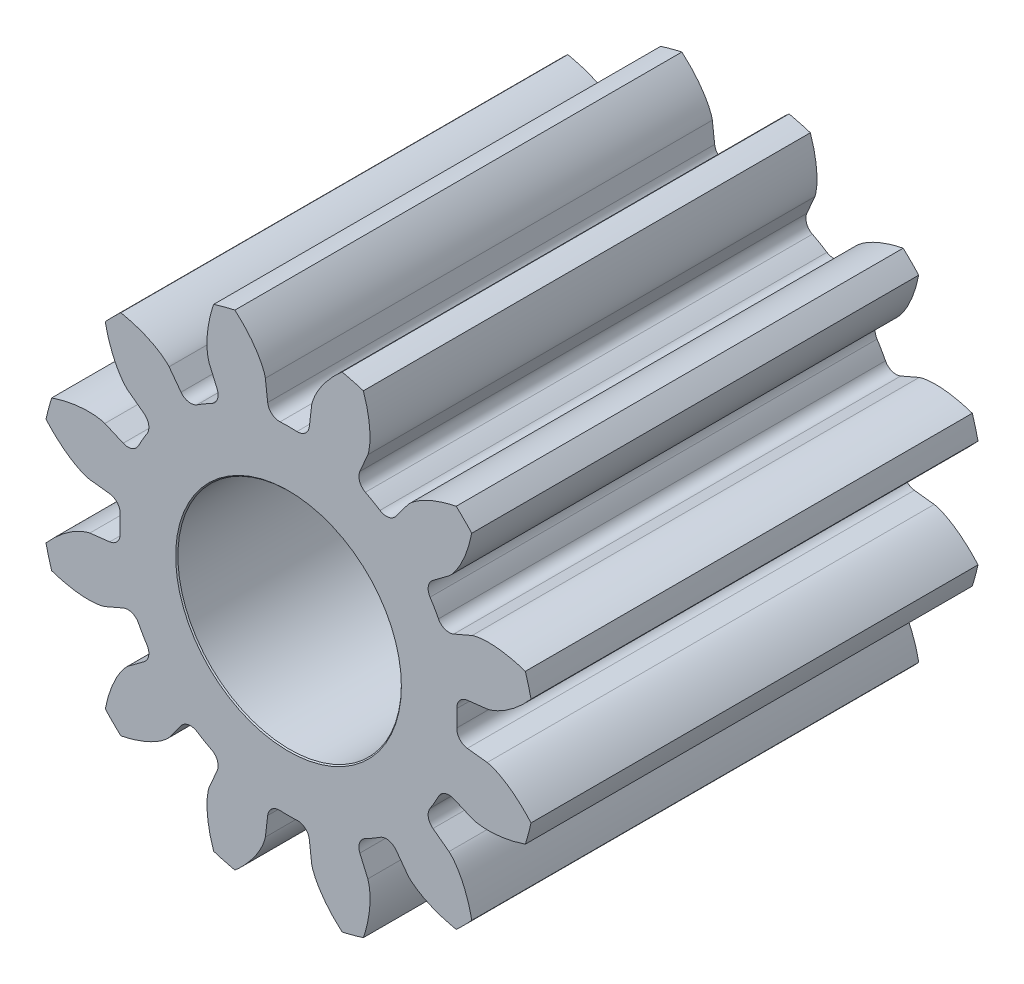
from build123d import *

# Parameters (mm, degrees)
BOSS_EXTRUDE1_DEPTH             = 5
BOSS_EXTRUDE1_DEPTH_BACK        = 5
SKETCH3_R                       = 5.55625
CUT_EXTRUDE1_DEPTH              = 10.313636676
FILLET1_R                       = 0.266307122
CIRPATTERN1_COUNT               = 12
FILLET1_OF_CIRPATTERN1_R        = 0.266307122
F_5_0MM_DOWEL_HOLE1_D           = 5
F_5_0MM_DOWEL_HOLE1_CSINK_D     = 5.05
F_5_0MM_DOWEL_HOLE1_CSINK_ANGLE = 90


with BuildPart() as part:
    # Sketch3 → Boss-Extrude1 (new, two sides: drawn at the far end of the back side and taken through both)
    with BuildSketch(Plane.XY.offset(-BOSS_EXTRUDE1_DEPTH_BACK)):
        Circle(SKETCH3_R)
    extrude(amount=BOSS_EXTRUDE1_DEPTH + BOSS_EXTRUDE1_DEPTH_BACK)

    # Sketch4 → Cut-Extrude1 (cut, symmetric)
    with BuildSketch(Plane.XY):
        with BuildLine():
            Line((3.744976316, 0.436358502), (4.445212559, 0.517948881))
            add(Edge.make_bspline(
                [(4.445212559, 0.517948881), (4.446988643, 0.518183904), (4.451958486, 0.518928669), (4.461305965, 0.520674333), (4.476476085, 0.52400013), (4.495673135, 0.528937043), (4.520313723, 0.536116762), (4.54910084, 0.54559681), (4.580461748, 0.557079488), (4.61425939, 0.570712843), (4.647674072, 0.585316581), (4.680706871, 0.600810831), (4.713330756, 0.617076935), (4.752496873, 0.637754625), (4.798959577, 0.663898969), (4.852488387, 0.696400297), (4.912241535, 0.735537021), (4.972050732, 0.777818405), (5.029985943, 0.821379591), (5.087404852, 0.86760016), (5.142164542, 0.913883496), (5.197824541, 0.964166137), (5.248586848, 1.011708006), (5.304042495, 1.067362637), (5.348387699, 1.112979688), (5.39297093, 1.162057664), (5.414486972, 1.186230835), (5.425405133, 1.198704801)],
                knots=[0, 0, 0, 0, 0, 0.005376749, 0.015083688, 0.02853182, 0.046610139, 0.064854849, 0.092110525, 0.119476176, 0.146842496, 0.174208854, 0.201574956, 0.228941013, 0.256307345, 0.307035032, 0.361767352, 0.416499661, 0.471231937, 0.525964282, 0.580696615, 0.635428982, 0.690161387, 0.744893688, 0.799626082, 0.854358408, 0.909090915, 0.909090915, 0.909090915, 0.909090915, 0.909090915], degree=4))
            ThreePointArc((5.425405133, 1.198704801), (5.55625, 0), (5.425405133, -1.198704801))
            add(Edge.make_bspline(
                [(4.445212559, -0.517948881), (4.446988643, -0.518183904), (4.451958486, -0.518928669), (4.461305965, -0.520674333), (4.476476085, -0.52400013), (4.495673135, -0.528937043), (4.520313723, -0.536116762), (4.54910084, -0.54559681), (4.580461748, -0.557079488), (4.61425939, -0.570712843), (4.647674072, -0.585316581), (4.680706871, -0.600810831), (4.713330756, -0.617076935), (4.752496873, -0.637754625), (4.798959577, -0.663898969), (4.852488387, -0.696400297), (4.912241535, -0.735537021), (4.972050732, -0.777818405), (5.029985943, -0.821379591), (5.087404852, -0.86760016), (5.142164542, -0.913883496), (5.197824541, -0.964166137), (5.248586848, -1.011708006), (5.304042495, -1.067362637), (5.348387699, -1.112979688), (5.39297093, -1.162057664), (5.414486972, -1.186230835), (5.425405133, -1.198704801)],
                knots=[0, 0, 0, 0, 0, 0.005376749, 0.015083688, 0.02853182, 0.046610139, 0.064854849, 0.092110525, 0.119476176, 0.146842496, 0.174208854, 0.201574956, 0.228941013, 0.256307345, 0.307035032, 0.361767352, 0.416499661, 0.471231937, 0.525964282, 0.580696615, 0.635428982, 0.690161387, 0.744893688, 0.799626082, 0.854358408, 0.909090915, 0.909090915, 0.909090915, 0.909090915, 0.909090915], degree=4))
            Line((4.445212559, -0.517948881), (3.744976316, -0.436358502))
            ThreePointArc((3.744976316, -0.436358502), (3.7703125, 0), (3.744976316, 0.436358502))
        make_face()
    cut_extrude1 = extrude(amount=CUT_EXTRUDE1_DEPTH, both=True, mode=Mode.SUBTRACT)

    # Fillet1
    fillet1_edges = [part.edges().sort_by_distance(p)[0] for p in [
        (3.744976316, -0.436358502, 0),
        (3.744976316, 0.436358502, 0),
    ]]
    fillet(fillet1_edges, radius=FILLET1_R)

    # CirPattern1: Cut-Extrude1 ×12 about axis
    cirpattern1_axis = Axis((0, 0, 5.000000033), (0, 0, -1))
    for i in range(1, CIRPATTERN1_COUNT):
        add(cut_extrude1.rotate(cirpattern1_axis, i * 360 / CIRPATTERN1_COUNT), mode=Mode.SUBTRACT)

    # Fillet1 of CirPattern1
    fillet1_of_cirpattern1_edges = [part.edges().sort_by_distance(p)[0] for p in [
        (3.025065375, -2.250385705, 0),
        (3.461423877, -1.49459061, 0),
        (1.49459061, -3.461423877, 0),
        (2.250385705, -3.025065375, 0),
        (-0.436358502, -3.744976316, 0),
        (0.436358502, -3.744976316, 0),
        (-2.250385705, -3.025065375, 0),
        (-1.49459061, -3.461423877, 0),
        (-3.461423877, -1.49459061, 0),
        (-3.025065375, -2.250385705, 0),
        (-3.744976316, 0.436358502, 0),
        (-3.744976316, -0.436358502, 0),
        (-3.025065375, 2.250385705, 0),
        (-3.461423877, 1.49459061, 0),
        (-1.49459061, 3.461423877, 0),
        (-2.250385705, 3.025065375, 0),
        (0.436358502, 3.744976316, 0),
        (-0.436358502, 3.744976316, 0),
        (2.250385705, 3.025065375, 0),
        (1.49459061, 3.461423877, 0),
        (3.461423877, 1.49459061, 0),
        (3.025065375, 2.250385705, 0),
    ]]
    fillet(fillet1_of_cirpattern1_edges, radius=FILLET1_OF_CIRPATTERN1_R)

    # Ø5.0mm Dowel Hole1 (through all)
    with Locations(Plane.XY.offset(5.000000033)):
        with Locations((0, 0)):
            CounterSinkHole(F_5_0MM_DOWEL_HOLE1_D / 2, F_5_0MM_DOWEL_HOLE1_CSINK_D / 2, counter_sink_angle=F_5_0MM_DOWEL_HOLE1_CSINK_ANGLE)


solid = part.part
